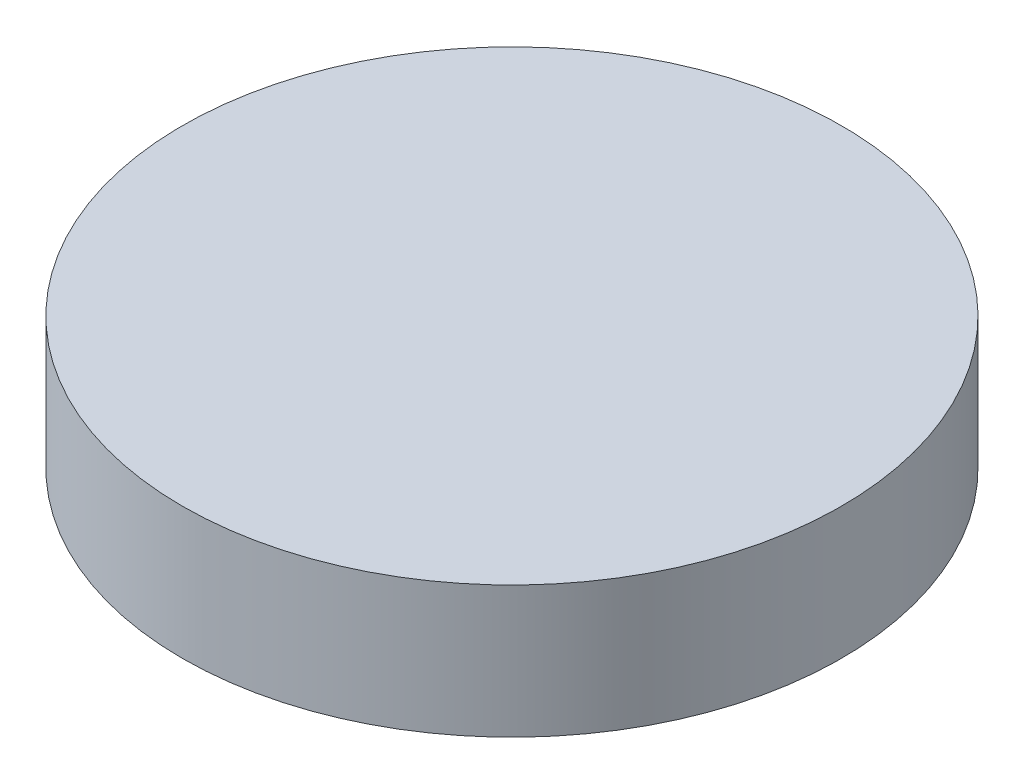
from build123d import *

# Parameters (mm, degrees)
SKETCH1_R           = 10
BOSS_EXTRUDE1_DEPTH = 3
CUT_EXTRUDE2_DEPTH  = 15.456832295
SKETCH3_R           = 10
BOSS_EXTRUDE2_DEPTH = 1


with BuildPart() as part:
    # Sketch1 → Boss-Extrude1 (new body)
    with BuildSketch(Plane(origin=(0, 0, 0), x_dir=(1, 0, 0), z_dir=(0, 1, 0))):
        with Locations(Location((0, 0, 0), (0, 0, 270))):
            Circle(SKETCH1_R)
    extrude(amount=BOSS_EXTRUDE1_DEPTH)

    # Sketch2 → Cut-Extrude2 (cut, through all)
    with BuildSketch(Plane(origin=(0, 3, 0), x_dir=(1, 0, 0), z_dir=(0, 1, 0))):
        Polygon((2.958730451, -2.753043307), (3.863570667, 1.18581408), (0.904840216, 3.938857387), (-2.958730451, 2.753043307), (-3.863570667, -1.18581408), (-0.904840216, -3.938857387), align=None)
    extrude(amount=-CUT_EXTRUDE2_DEPTH, mode=Mode.SUBTRACT)

    # Sketch3 → Boss-Extrude2 (add)
    with BuildSketch(Plane(origin=(0, 3, 0), x_dir=(1, 0, 0), z_dir=(0, 1, 0))):
        with Locations(Location((0, 0, 0), (0, 0, 270))):
            Circle(SKETCH3_R)
    extrude(amount=BOSS_EXTRUDE2_DEPTH)


solid = part.part
